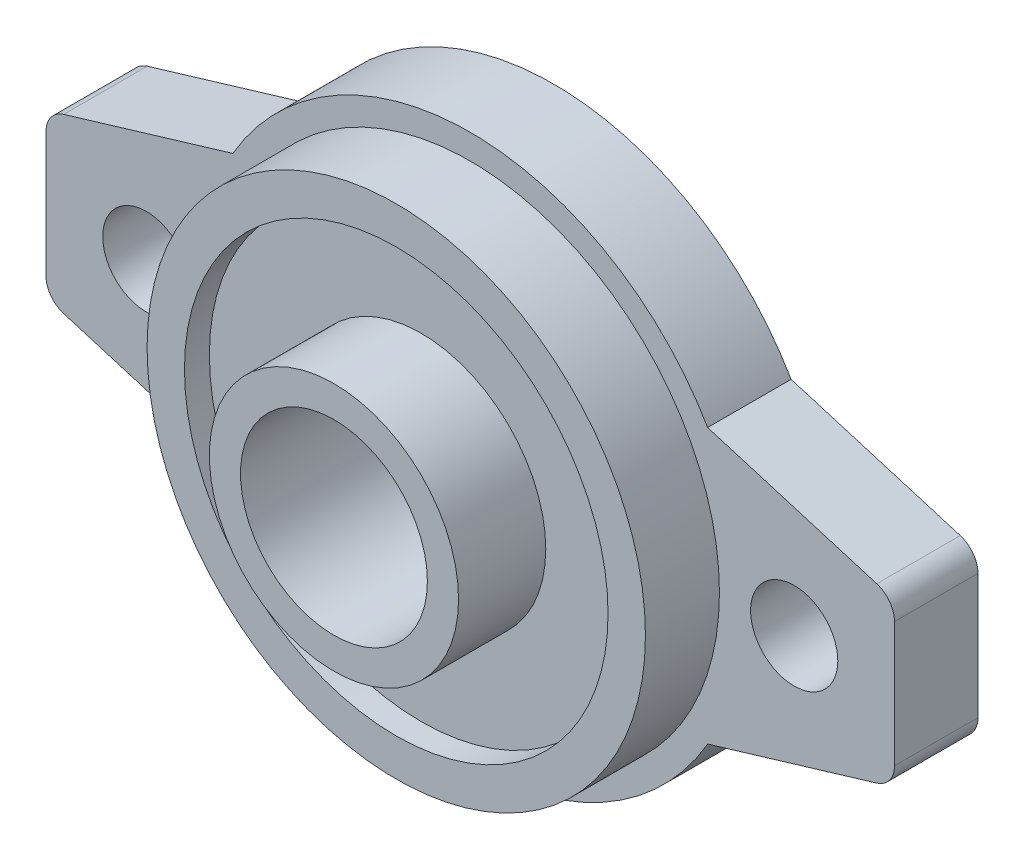
from build123d import *

# Parameters (mm, degrees)
SKETCH_1_R      = 10
SKETCH_1_R_2    = 3.5
EXTRUDE_1_DEPTH = 6.7
SKETCH_1_4_R    = 20
SKETCH_1_4_R_2  = 17
EXTRUDE_2_DEPTH = 12.64
SKETCH_1_5_R    = 17
SKETCH_1_5_R_2  = 10
EXTRUDE_3_DEPTH = 10.64
SKETCH_1_6_R    = 10
SKETCH_1_6_R_2  = 7.5
EXTRUDE_4_DEPTH = 17.64
FILLET_1_R      = 2


with BuildPart() as part:
    # 스케치1 → 보스-돌출1 (new body)
    with BuildSketch(Plane.XY):
        with BuildLine():
            Line((19.052558883, 11), (34.052558883, 6.5))
            Line((34.052558883, 6.5), (34.052558883, -6.5))
            Line((34.052558883, -6.5), (19.052558883, -11))
            ThreePointArc((19.052558883, -11), (0, -22), (-19.052558883, -11))
            Line((-19.052558883, -11), (-34.052558883, -6.5))
            Line((-34.052558883, -6.5), (-34.052558883, 6.5))
            Line((-34.052558883, 6.5), (-19.052558883, 11))
            ThreePointArc((-19.052558883, 11), (0, 22), (19.052558883, 11))
        make_face()
        Circle(SKETCH_1_R, mode=Mode.SUBTRACT)
        with Locations((26, 0)):
            Circle(SKETCH_1_R_2, mode=Mode.SUBTRACT)
        with Locations((-26, 0)):
            Circle(SKETCH_1_R_2, mode=Mode.SUBTRACT)
    extrude(amount=EXTRUDE_1_DEPTH)

    # 스케치1<4> → 보스-돌출2 (add)
    with BuildSketch(Plane.XY):
        with Locations(Location((0, 0, 0), (0, 0, 180))):
            Circle(SKETCH_1_4_R)
        with Locations(Location((0, 0, 0), (0, 0, 180))):
            Circle(SKETCH_1_4_R_2, mode=Mode.SUBTRACT)
    extrude(amount=EXTRUDE_2_DEPTH)

    # 스케치1<5> → 보스-돌출3 (add)
    with BuildSketch(Plane.XY):
        with Locations(Location((0, 0, 0), (0, 0, 180))):
            Circle(SKETCH_1_5_R)
        Circle(SKETCH_1_5_R_2, mode=Mode.SUBTRACT)
    extrude(amount=EXTRUDE_3_DEPTH)

    # 스케치1<6> → 보스-돌출4 (add)
    with BuildSketch(Plane.XY):
        Circle(SKETCH_1_6_R)
        Circle(SKETCH_1_6_R_2, mode=Mode.SUBTRACT)
    extrude(amount=EXTRUDE_4_DEPTH)

    # 필렛1
    fillet_1_edges = [part.edges().sort_by_distance(p)[0] for p in [
        (-34.052558883, -6.5, 3.35),
        (-34.052558883, 6.5, 3.35),
        (34.052558883, 6.5, 3.35),
        (34.052558883, -6.5, 3.35),
    ]]
    fillet(fillet_1_edges, radius=FILLET_1_R)


solid = part.part
